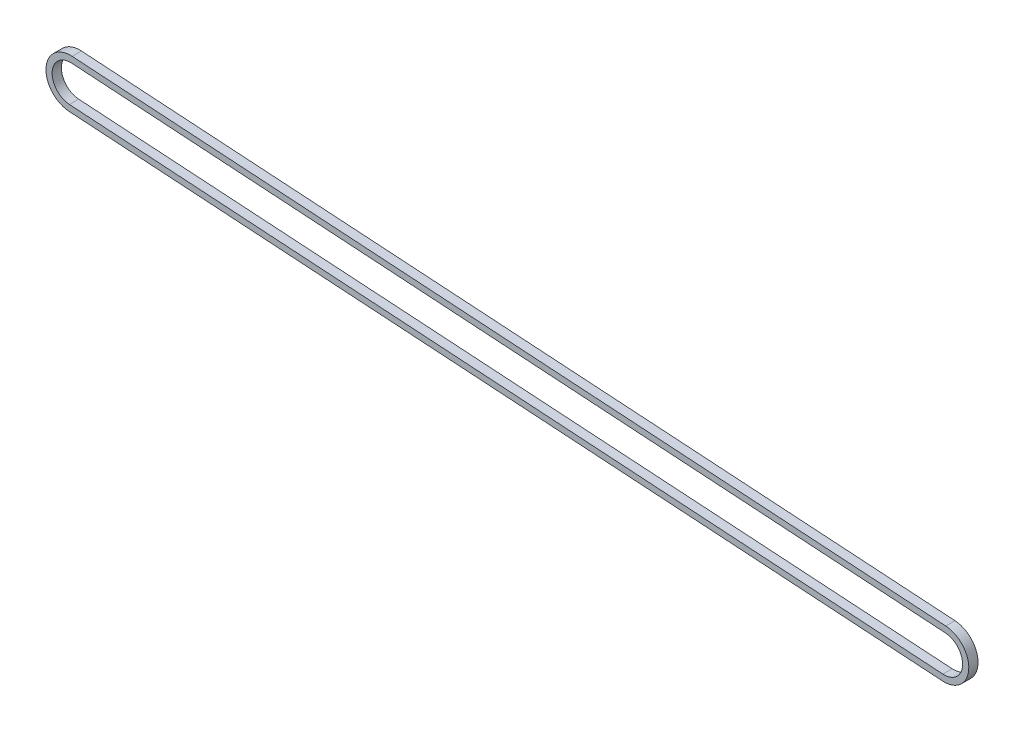
from build123d import *

# Parameters (mm, degrees)
EXTRUDE_THIN1_DEPTH = 3


with BuildPart() as part:
    # Sketch2 → Extrude-Thin1 (new body)
    with BuildSketch(Plane.XY):
        with BuildLine():
            Line((282.917521608, -26.341681114), (-0.51708635, -7.983271366))
            ThreePointArc((-0.51708635, -7.983271366), (-7.983271366, 0.51708635), (0.51708635, 7.983271366))
            Line((0.51708635, 7.983271366), (283.951694308, -10.375138382))
            ThreePointArc((283.951694308, -10.375138382), (291.417879325, -18.875496098), (282.917521608, -26.341681114))
        make_face()
        with BuildLine():
            Line((283.046793196, -24.345863273), (-0.387814762, -5.987453525))
            ThreePointArc((-0.387814762, -5.987453525), (-5.987453525, 0.387814762), (0.387814762, 5.987453525))
            Line((0.387814762, 5.987453525), (283.822422721, -12.370956223))
            ThreePointArc((283.822422721, -12.370956223), (289.422061483, -18.74622451), (283.046793196, -24.345863273))
        make_face(mode=Mode.SUBTRACT)
    extrude(amount=EXTRUDE_THIN1_DEPTH)


solid = part.part
